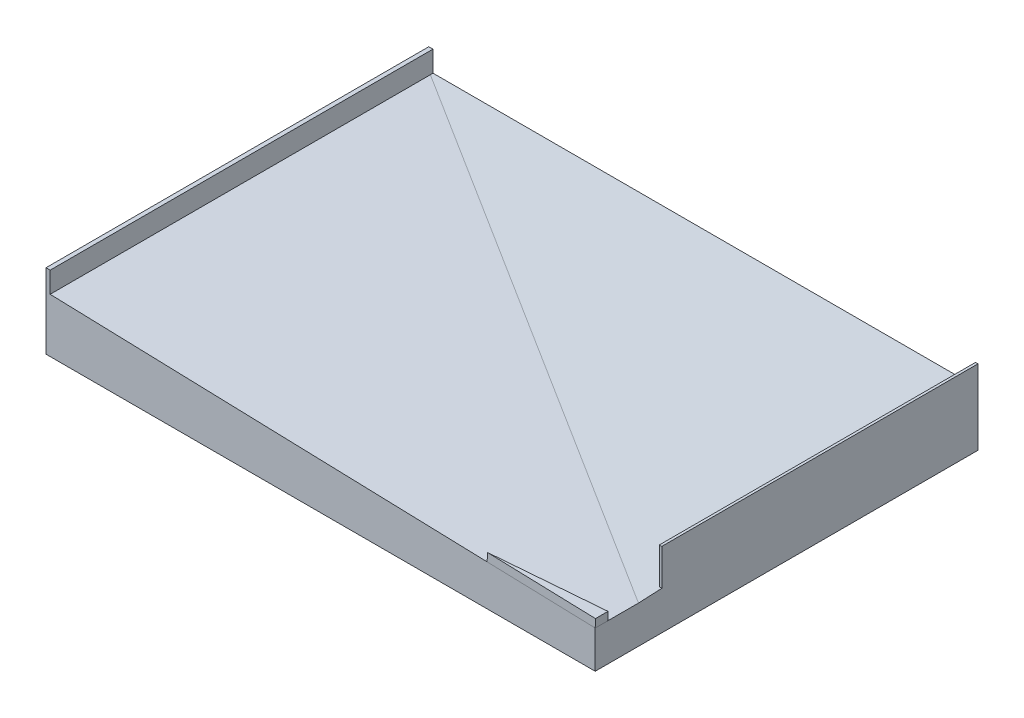
from build123d import *

# Parameters (mm, degrees)
BOSS_EXTRUDE2_DEPTH = 584.2
BOSS_EXTRUDE3_REACH = 1027.028
BOSS_EXTRUDE4_DEPTH = 114.3
BOSS_EXTRUDE5_DEPTH = 12.7


with BuildPart() as part:
    # Sketch3 → Boss-Extrude2 (new body)
    with BuildSketch(Plane.XY):
        Polygon((-419.1, 0), (419.1, 0), (419.1, 57.15), (-419.1, 82.55), align=None)
    extrude(amount=-BOSS_EXTRUDE2_DEPTH)

    # Boss-Extrude3: up to this face of the body (flat: up to its plane)
    boss_extrude3_end = Plane(part.part.faces().sort_by_distance((-419.1, 41.275, -292.1))[0])
    # Sketch4 → Boss-Extrude3 (add, up to the picked face)
    with BuildSketch(Plane(origin=(419.1, 0, 0), x_dir=(0, 0, -1), z_dir=(1, 0, 0)), mode=Mode.PRIVATE) as boss_extrude3_sk1:
        Polygon((66.04, 57.15), (66.04, 0), (584.2, 0), (584.2, 82.55), align=None)
    boss_extrude3_tool1 = split(extrude(boss_extrude3_sk1.sketch, amount=-BOSS_EXTRUDE3_REACH, mode=Mode.PRIVATE), bisect_by=boss_extrude3_end, keep=Keep.BOTH, mode=Mode.PRIVATE)
    add(boss_extrude3_tool1.solids().sort_by(Axis((419.1, 35.309848, -340.821818), (-1, 0, 0)))[0])

    # Sketch5 → Boss-Extrude4 (add)
    with BuildSketch(Plane(origin=(0, 0, 0), x_dir=(1, 0, 0), z_dir=(0, 1, 0))):
        Polygon((-419.1, 584.2), (-412.75, 584.2), (-412.75, 579.774242424), (-412.75, 6.35), (-412.75, 0), (-419.1, 0), align=None)
        Polygon((419.1, 584.2), (419.1, 101.6), (415.333086298, 101.6), (415.333086298, 579.638290514), (415.333086298, 584.2), align=None)
    extrude(amount=BOSS_EXTRUDE4_DEPTH)


with BuildPart() as body_2:
    # Sketch6 → Boss-Extrude5 (new body)
    with BuildSketch(Plane(origin=(2.114724771, 69.785917431, 0), x_dir=(0.9995411791453815, -0.03028912664076896, 0), z_dir=(0.03028912664076896, 0.9995411791453815, 0))):
        Polygon((252.21531488, 0), (417.176684592, 0), (417.176684592, 19.129276533), align=None)
    extrude(amount=BOSS_EXTRUDE5_DEPTH)


solid = Compound([part.part, body_2.part])
